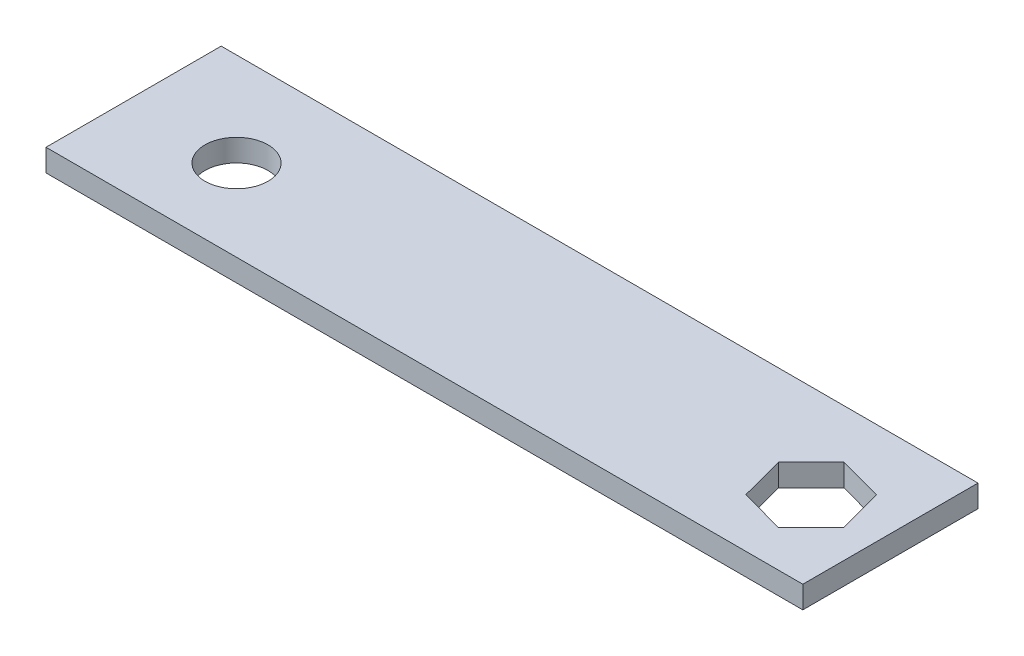
from build123d import *

# Parameters (mm, degrees)
SKETCH1_W           = 108
SKETCH1_H           = 25
SKETCH1_R           = 4.5
BOSS_EXTRUDE1_DEPTH = 3.175


with BuildPart() as part:
    # Sketch1 → Boss-Extrude1 (new body)
    with BuildSketch(Plane(origin=(0, 0, 0), x_dir=(1, 0, 0), z_dir=(0, 1, 0))):
        with Locations((54, 12.5)):
            Rectangle(SKETCH1_W, SKETCH1_H)
        with Locations(Location((15.5424302, 11.644702803, 0), (0, 0, 270))):
            Circle(SKETCH1_R, mode=Mode.SUBTRACT)
        Polygon((95.851854644, 18.016977652), (91.178590522, 13.366758848), (92.869166079, 6.994483999), (99.233005757, 5.272427953), (103.906269878, 9.922646757), (102.215694322, 16.294921607), align=None, mode=Mode.SUBTRACT)
    extrude(amount=BOSS_EXTRUDE1_DEPTH)


solid = part.part
